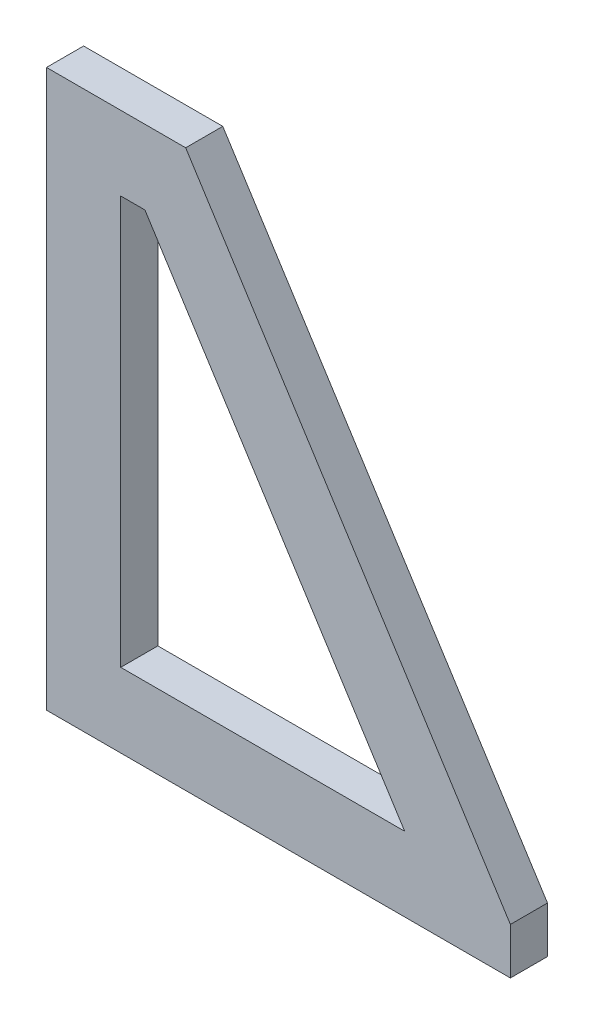
from build123d import *

# Parameters (mm, degrees)
EXTRUDE_1_DEPTH = 4


with BuildPart() as part:
    # 草图1 → 凸台-拉伸1 (new, symmetric)
    with BuildSketch(Plane.XY):
        Polygon((0, 0), (100, 0), (100, 10), (30, 120), (0, 120), align=None)
        Polygon((16, 104), (21.21686573, 104), (77.21686573, 16), (16, 16), align=None, mode=Mode.SUBTRACT)
    extrude(amount=EXTRUDE_1_DEPTH, both=True)


solid = part.part
